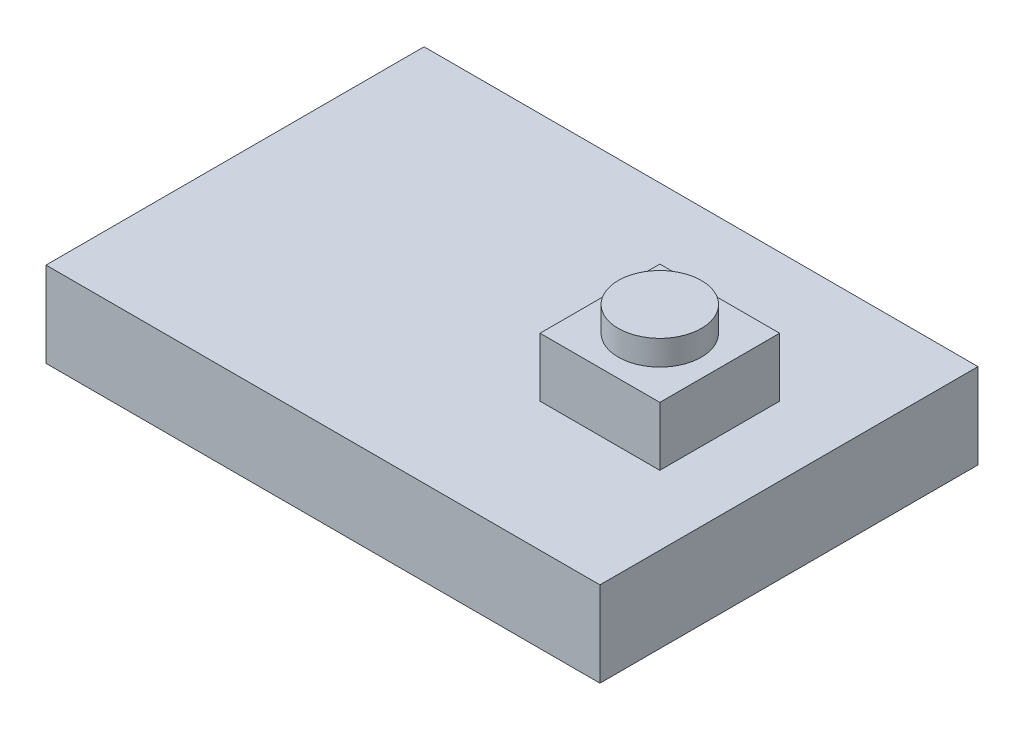
from build123d import *

# Parameters (mm, degrees)
SKETCH_1_W      = 40
SKETCH_1_H      = 27.3
EXTRUDE_1_DEPTH = 6.15
EXTRUDE_START   = -6.15
SKETCH_2_W      = 8.65
SKETCH_2_H      = 8.65
EXTRUDE_2_DEPTH = 10.4
SKETCH_3_R      = 3
EXTRUDE_3_DEPTH = 1.8


with BuildPart() as part:
    # 草图1 → 凸台-拉伸1 (new body)
    with BuildSketch(Plane(origin=(0, 0, 0), x_dir=(1, 0, 0), z_dir=(0, 1, 0))):
        Rectangle(SKETCH_1_W, SKETCH_1_H)
    extrude(amount=EXTRUDE_1_DEPTH)

    # 草图2 → 凸台-拉伸2 (add)
    with BuildSketch(Plane(origin=(0, 6.15, 0), x_dir=(1, 0, 0), z_dir=(0, 1, 0)).offset(EXTRUDE_START)):
        with Locations((10.675, 0)):
            Rectangle(SKETCH_2_W, SKETCH_2_H)
    extrude(amount=EXTRUDE_2_DEPTH)

    # 草图3 → 凸台-拉伸3 (add)
    with BuildSketch(Plane(origin=(0, 10.4, 0), x_dir=(1, 0, 0), z_dir=(0, 1, 0))):
        with Locations(Location((10.675, 0, 0), (0, 0, 270))):
            Circle(SKETCH_3_R)
    extrude(amount=EXTRUDE_3_DEPTH)


solid = part.part
